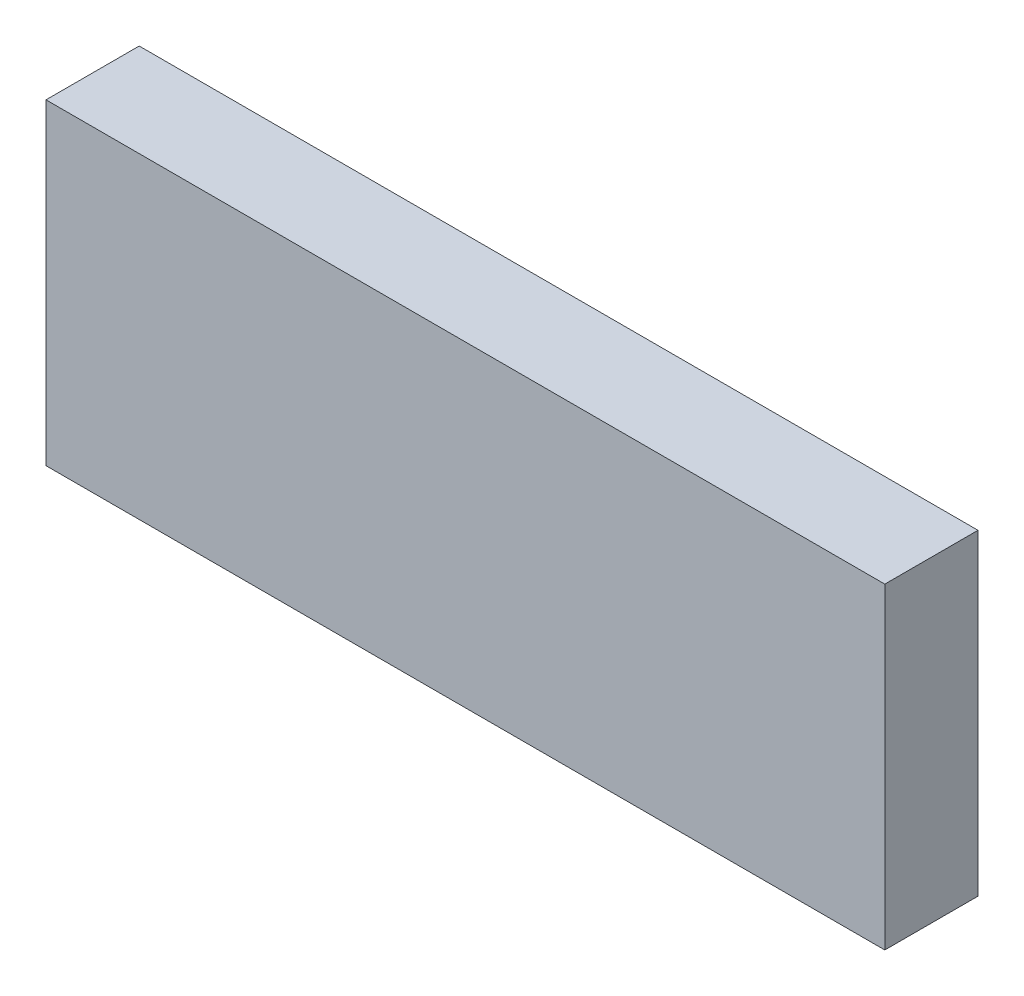
from build123d import *

# Parameters (mm, degrees)
SKETCH2_W           = 4500
SKETCH2_H           = 1700
BOSS_EXTRUDE1_DEPTH = 500


with BuildPart() as part:
    # Sketch2 → Boss-Extrude1 (new body)
    with BuildSketch(Plane.XY):
        with Locations((2250, 850)):
            Rectangle(SKETCH2_W, SKETCH2_H)
    extrude(amount=BOSS_EXTRUDE1_DEPTH)


solid = part.part
